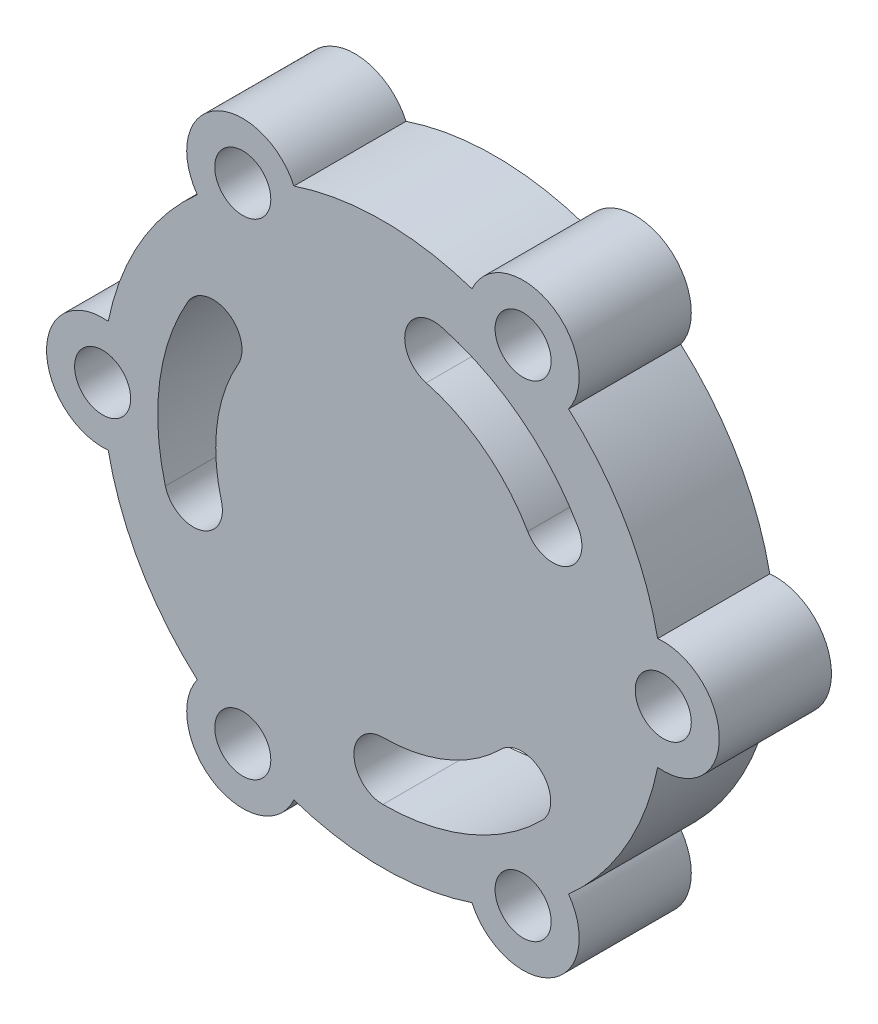
from build123d import *

# Parameters (mm, degrees)
SKETCH2_R           = 5
BOSS_EXTRUDE1_DEPTH = 10


with BuildPart() as part:
    # Sketch2 → Boss-Extrude1 (new, symmetric)
    with BuildSketch(Plane.XY):
        with BuildLine():
            ThreePointArc((85.88315603, 117.410181971), (70, 120), (54.11684397, 117.410181971))
            ThreePointArc((54.11684397, 117.410181971), (40, 121.961524227), (36.88315603, 107.4603076))
            ThreePointArc((36.88315603, 107.4603076), (26.698729811, 95), (21, 79.949874371))
            ThreePointArc((21, 79.949874371), (10, 70), (21, 60.050125629))
            ThreePointArc((21, 60.050125629), (26.698729811, 45), (36.88315603, 32.5396924))
            ThreePointArc((36.88315603, 32.5396924), (40, 18.038475773), (54.11684397, 22.589818029))
            ThreePointArc((54.11684397, 22.589818029), (70, 20), (85.88315603, 22.589818029))
            ThreePointArc((85.88315603, 22.589818029), (100, 18.038475773), (103.11684397, 32.5396924))
            ThreePointArc((103.11684397, 32.5396924), (113.301270189, 45), (119, 60.050125629))
            ThreePointArc((119, 60.050125629), (130, 70), (119, 79.949874371))
            ThreePointArc((119, 79.949874371), (113.301270189, 95), (103.11684397, 107.4603076))
            ThreePointArc((103.11684397, 107.4603076), (100, 121.961524227), (85.88315603, 117.410181971))
        make_face()
        with Locations((120, 70)):
            Circle(SKETCH2_R, mode=Mode.SUBTRACT)
        with Locations((95, 26.698729811)):
            Circle(SKETCH2_R, mode=Mode.SUBTRACT)
        with Locations((45, 26.698729811)):
            Circle(SKETCH2_R, mode=Mode.SUBTRACT)
        with Locations((20, 70)):
            Circle(SKETCH2_R, mode=Mode.SUBTRACT)
        with Locations((45, 113.301270189)):
            Circle(SKETCH2_R, mode=Mode.SUBTRACT)
        with Locations((95, 113.301270189)):
            Circle(SKETCH2_R, mode=Mode.SUBTRACT)
        with BuildLine():
            ThreePointArc((104.793766493, 90.088190451), (94.45783105, 101.874065989), (80.398412541, 108.80740392))
            ThreePointArc((80.398412541, 108.80740392), (74.058666579, 105.147149882), (77.718920616, 98.80740392))
            ThreePointArc((77.718920616, 98.80740392), (88.15546898, 93.660667831), (95.828011772, 84.911809549))
            ThreePointArc((95.828011772, 84.911809549), (102.899079583, 83.017122639), (104.793766493, 90.088190451))
        make_face(mode=Mode.SUBTRACT)
        with BuildLine():
            ThreePointArc((70, 29.823619098), (85.374835344, 32.881863994), (98.408991379, 41.591008621))
            ThreePointArc((98.408991379, 41.591008621), (98.408991379, 48.911516696), (91.088483304, 48.911516696))
            ThreePointArc((91.088483304, 48.911516696), (81.413004922, 42.44656873), (70, 40.176380902))
            ThreePointArc((70, 40.176380902), (64.823619098, 35), (70, 29.823619098))
        make_face(mode=Mode.SUBTRACT)
        with BuildLine():
            ThreePointArc((35.206233507, 90.088190451), (30.167333606, 75.244070016), (31.19259608, 59.601587459))
            ThreePointArc((31.19259608, 59.601587459), (37.532342042, 55.941333421), (41.19259608, 62.281079384))
            ThreePointArc((41.19259608, 62.281079384), (40.431526098, 73.892763439), (44.171988228, 84.911809549))
            ThreePointArc((44.171988228, 84.911809549), (42.277301319, 91.982877361), (35.206233507, 90.088190451))
        make_face(mode=Mode.SUBTRACT)
    extrude(amount=BOSS_EXTRUDE1_DEPTH, both=True)


solid = part.part
